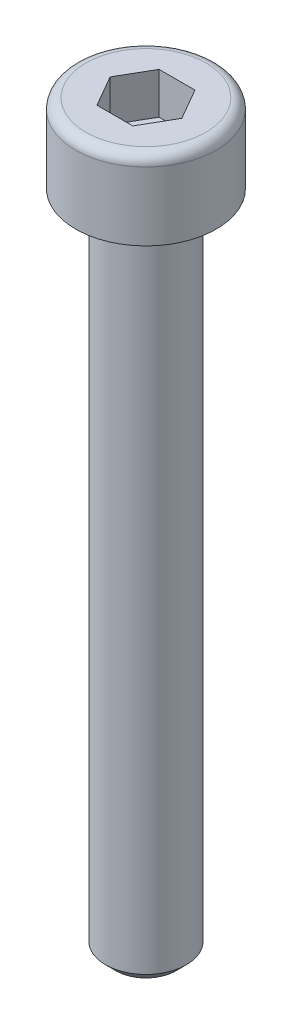
from build123d import *

# Parameters (mm, degrees)
ENL_V_MAT_EXTRU_1_DEPTH = 2


with BuildPart() as part:
    # Esquisse1 → Révolution1 (revolve)
    with BuildSketch(Plane.XY):
        with BuildLine():
            Line((0, 3.8), (-2.9, 3.8))
            ThreePointArc((-2.9, 3.8), (-3.253553391, 3.653553391), (-3.4, 3.3))
            Line((-3.4, 3.3), (-3.4, 0))
            Line((-3.4, 0), (-1.95, 0))
            Line((-1.95, 0), (-1.95, -31.5))
            Line((-1.95, -31.5), (-1.45, -32))
            Line((-1.45, -32), (0, -32))
            Line((0, -32), (0, 3.8))
        make_face()
    revolve(axis=Axis((0, 3.8, 0), (0, -1, 0)))

    # Esquisse2 → Enlèv. mat.-Extru.1 (cut)
    with BuildSketch(Plane(origin=(0, 3.8, 0), x_dir=(-1, 0, 0), z_dir=(0, 1, 0))):
        Polygon((-1.732050808, 0), (-0.866025404, -1.5), (0.866025404, -1.5), (1.732050808, 0), (0.866025404, 1.5), (-0.866025404, 1.5), align=None)
    extrude(amount=-ENL_V_MAT_EXTRU_1_DEPTH, mode=Mode.SUBTRACT)


solid = part.part
